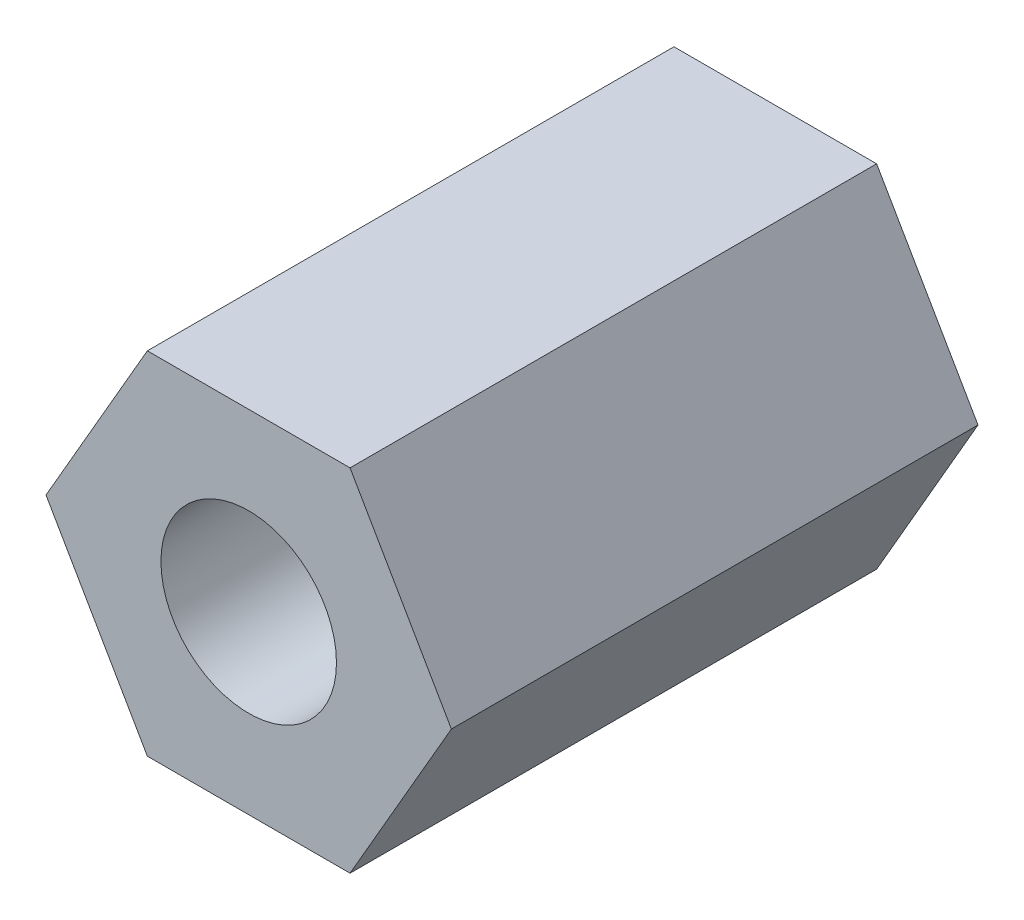
from build123d import *

# Parameters (mm, degrees)
SKETCH1_R           = 1.5
BOSS_EXTRUDE1_DEPTH = 9


with BuildPart() as part:
    # Sketch1 → Boss-Extrude1 (new body)
    with BuildSketch(Plane.XY):
        Polygon((3.464101615, 0), (1.732050808, 3), (-1.732050808, 3), (-3.464101615, 0), (-1.732050808, -3), (1.732050808, -3), align=None)
        Circle(SKETCH1_R, mode=Mode.SUBTRACT)
    extrude(amount=BOSS_EXTRUDE1_DEPTH)


solid = part.part
